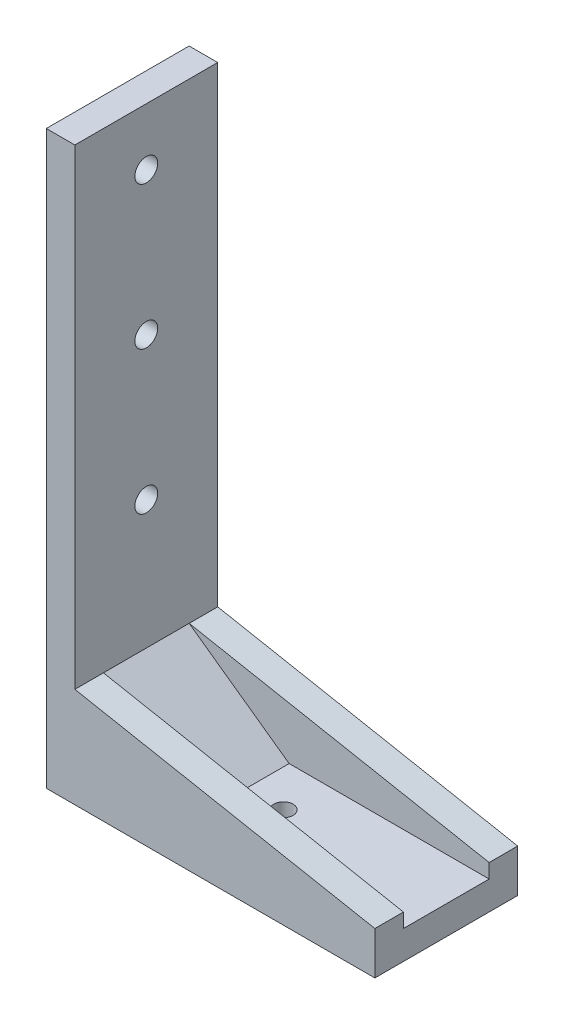
from build123d import *

# Parameters (mm, degrees)
BOSS_EXTRUDE1_DEPTH = 25
SKETCH3_R           = 4
CUT_EXTRUDE2_DEPTH  = 228.266363547
CUT_EXTRUDE3_REACH  = 234.056
SKETCH4_R           = 3.4
BOSS_EXTRUDE2_DEPTH = 50
BOSS_EXTRUDE3_DEPTH = 10


with BuildPart() as part:
    # Sketch1 → Boss-Extrude1 (new, symmetric)
    with BuildSketch(Plane.XY):
        Polygon((0, 0), (0, 200), (10, 200), (10, 10), (115, 10), (115, 0), align=None)
    extrude(amount=BOSS_EXTRUDE1_DEPTH, both=True)

    # Sketch3 → Cut-Extrude2 (cut, through all)
    with BuildSketch(Plane(origin=(10, 0, 0), x_dir=(0, 0, -1), z_dir=(1, 0, 0))):
        with Locations((0, 180)):
            Circle(SKETCH3_R)
        with Locations((0, 130)):
            Circle(SKETCH3_R)
        with Locations((0, 80)):
            Circle(SKETCH3_R)
    extrude(amount=-CUT_EXTRUDE2_DEPTH, mode=Mode.SUBTRACT)

    # Sketch4 → Cut-Extrude3 (cut, up to next)
    with BuildSketch(Plane.XZ, mode=Mode.PRIVATE) as cut_extrude3_sk1:
        with Locations(Location((58, 0, 0), (0, 0, 270))):
            Circle(SKETCH4_R)
    cut_extrude3_tool1 = extrude(cut_extrude3_sk1.sketch, amount=-CUT_EXTRUDE3_REACH, mode=Mode.PRIVATE) & part.part
    add(cut_extrude3_tool1.solids().sort_by_distance((58, 0, 0))[0], mode=Mode.SUBTRACT)

    # Sketch5 → Boss-Extrude2 (add)
    with BuildSketch(Plane(origin=(0, 0, -25), x_dir=(-1, 0, 0), z_dir=(0, 0, -1))):
        Polygon((-45, 10), (-10, 10), (-10, 35), align=None)
    extrude(amount=-BOSS_EXTRUDE2_DEPTH)

    # Sketch6 → Boss-Extrude3 (add)
    with BuildSketch(Plane(origin=(0, 0, -25), x_dir=(-1, 0, 0), z_dir=(0, 0, -1))):
        Polygon((-115, 10), (-10, 10), (-10, 35), (-115, 15), align=None)
    boss_extrude3 = extrude(amount=-BOSS_EXTRUDE3_DEPTH)

    # Mirror2: Boss-Extrude3 across plane
    add(boss_extrude3.mirror(Plane(origin=(0, 0, 0), x_dir=(1, 0, 0), z_dir=(0, 0, -1))))


solid = part.part
